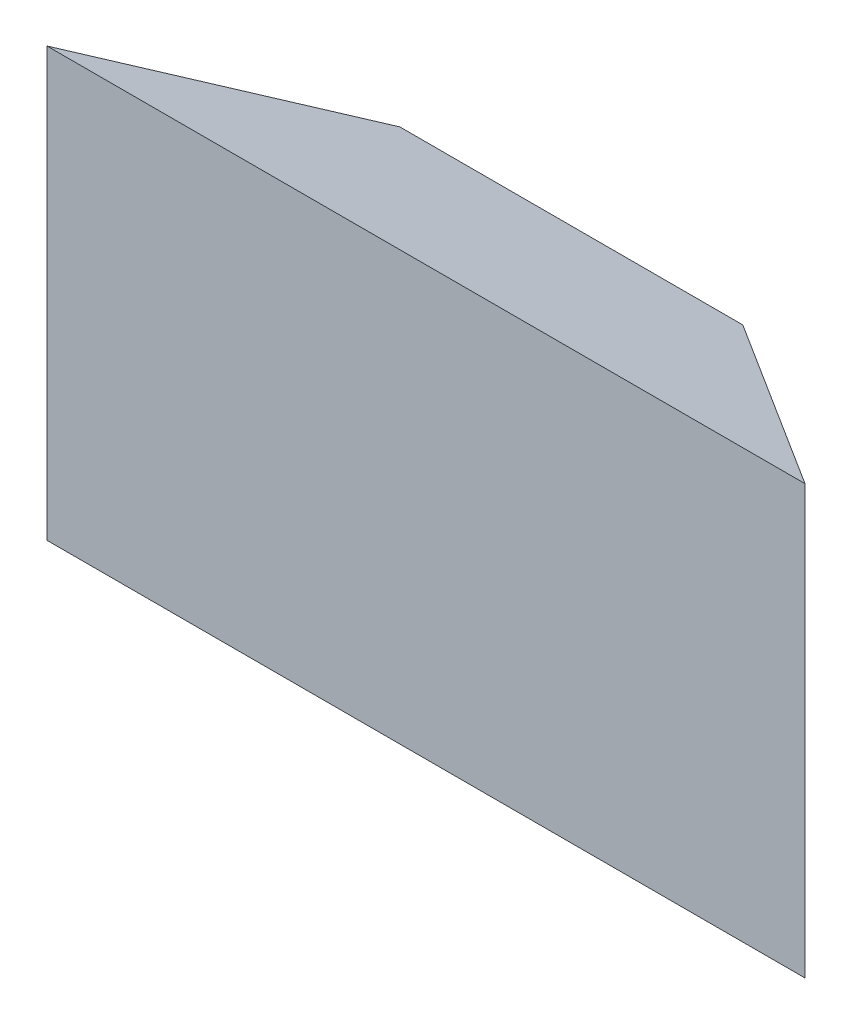
from build123d import *

# Parameters (mm, degrees)
SKETCH_7_W               = 236
SKETCH_7_H               = 125
EXTRUDE_7_DEPTH          = 100
EXTRUDE_7_TAPER          = -55
CUT_EXTRUDE_1_DEPTH      = 347.667748341
CUT_EXTRUDE_1_DEPTH_BACK = 347.667748341


with BuildPart() as part:
    # 草图7 → 凸台-拉伸7 (new body)
    with BuildSketch(Plane.XY):
        Rectangle(SKETCH_7_W, SKETCH_7_H)
    extrude(amount=EXTRUDE_7_DEPTH, taper=EXTRUDE_7_TAPER)

    # 草图9 → 切除-拉伸1 (cut, two sides: drawn at the far end of the back side and taken through both)
    with BuildSketch(Plane(origin=(0, 0, 0), x_dir=(0, 0, -1), z_dir=(1, 0, 0)).offset(-CUT_EXTRUDE_1_DEPTH_BACK)):
        Polygon((0, 62.5), (-205.943924003, 117.682508123), (-205.943924003, 317.682508123), (0, 317.682508123), align=None)
    extrude(amount=CUT_EXTRUDE_1_DEPTH + CUT_EXTRUDE_1_DEPTH_BACK, mode=Mode.SUBTRACT)


solid = part.part
